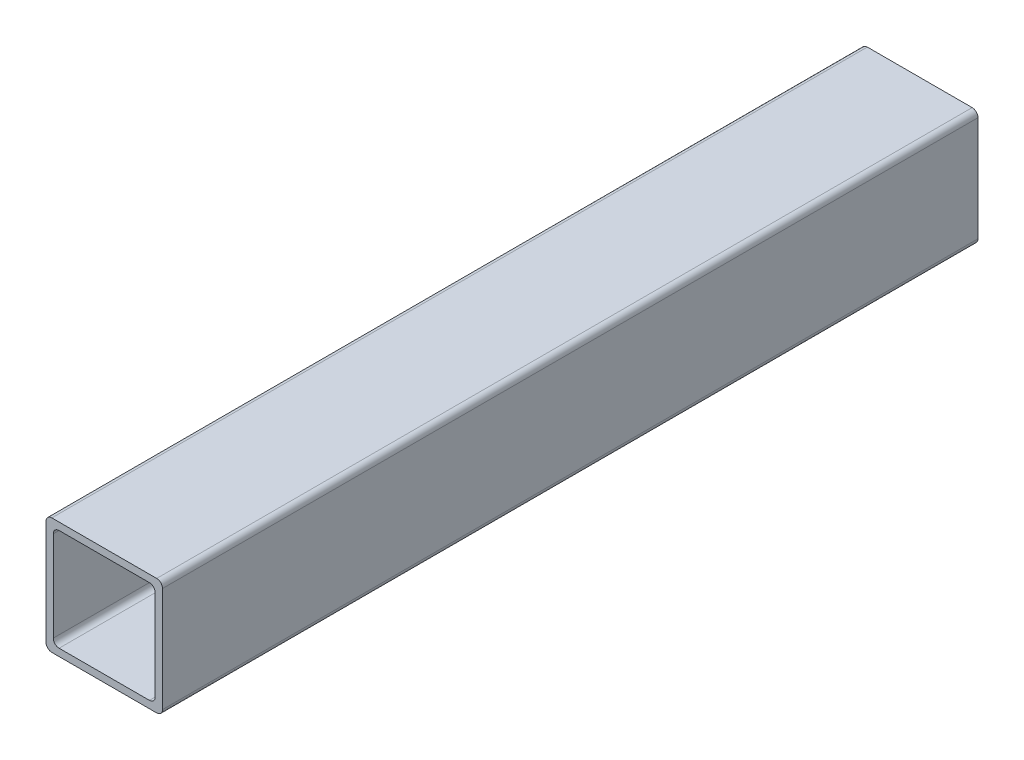
from build123d import *

# Parameters (mm, degrees)
BOSS_EXTRUDE1_DEPTH = 177.8


with BuildPart() as part:
    # Sketch1 → Boss-Extrude1 (new, symmetric)
    with BuildSketch(Plane.XY):
        with BuildLine():
            Line((-22.86, -25.4), (22.86, -25.4))
            ThreePointArc((22.86, -25.4), (24.656051224, -24.656051224), (25.4, -22.86))
            Line((25.4, -22.86), (25.4, 22.86))
            ThreePointArc((25.4, 22.86), (24.656051224, 24.656051224), (22.86, 25.4))
            Line((22.86, 25.4), (-22.86, 25.4))
            ThreePointArc((-22.86, 25.4), (-24.656051224, 24.656051224), (-25.4, 22.86))
            Line((-25.4, 22.86), (-25.4, -22.86))
            ThreePointArc((-25.4, -22.86), (-24.656051224, -24.656051224), (-22.86, -25.4))
        make_face()
        with BuildLine():
            Line((-19.685, 22.225), (19.685, 22.225))
            ThreePointArc((19.685, 22.225), (21.481051224, 21.481051224), (22.225, 19.685))
            Line((22.225, 19.685), (22.225, -19.685))
            ThreePointArc((22.225, -19.685), (21.481051224, -21.481051224), (19.685, -22.225))
            Line((19.685, -22.225), (-19.685, -22.225))
            ThreePointArc((-19.685, -22.225), (-21.481051224, -21.481051224), (-22.225, -19.685))
            Line((-22.225, -19.685), (-22.225, 19.685))
            ThreePointArc((-22.225, 19.685), (-21.481051224, 21.481051224), (-19.685, 22.225))
        make_face(mode=Mode.SUBTRACT)
    extrude(amount=BOSS_EXTRUDE1_DEPTH, both=True)


solid = part.part
